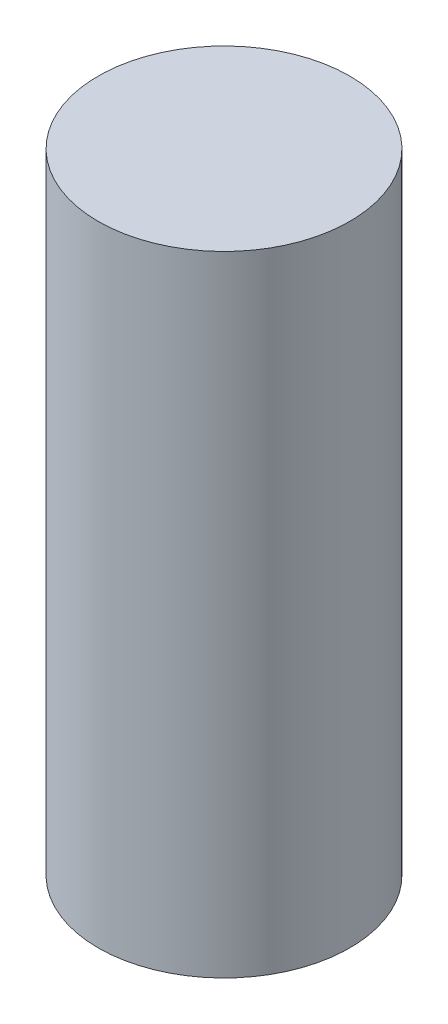
from build123d import *

# Parameters (mm, degrees)
SKETCH1_W = 200
SKETCH1_H = 1000


with BuildPart() as part:
    # Sketch1 → Revolve1 (revolve)
    with BuildSketch(Plane.XY, mode=Mode.PRIVATE) as revolve1_sk:
        with Locations((100, 500)):
            Rectangle(SKETCH1_W, SKETCH1_H)
    revolve(revolve1_sk.sketch.rotate(Axis((0, 0, 0), (0, 1, 0)), 90), axis=Axis((0, 0, 0), (0, 1, 0)))


solid = part.part
